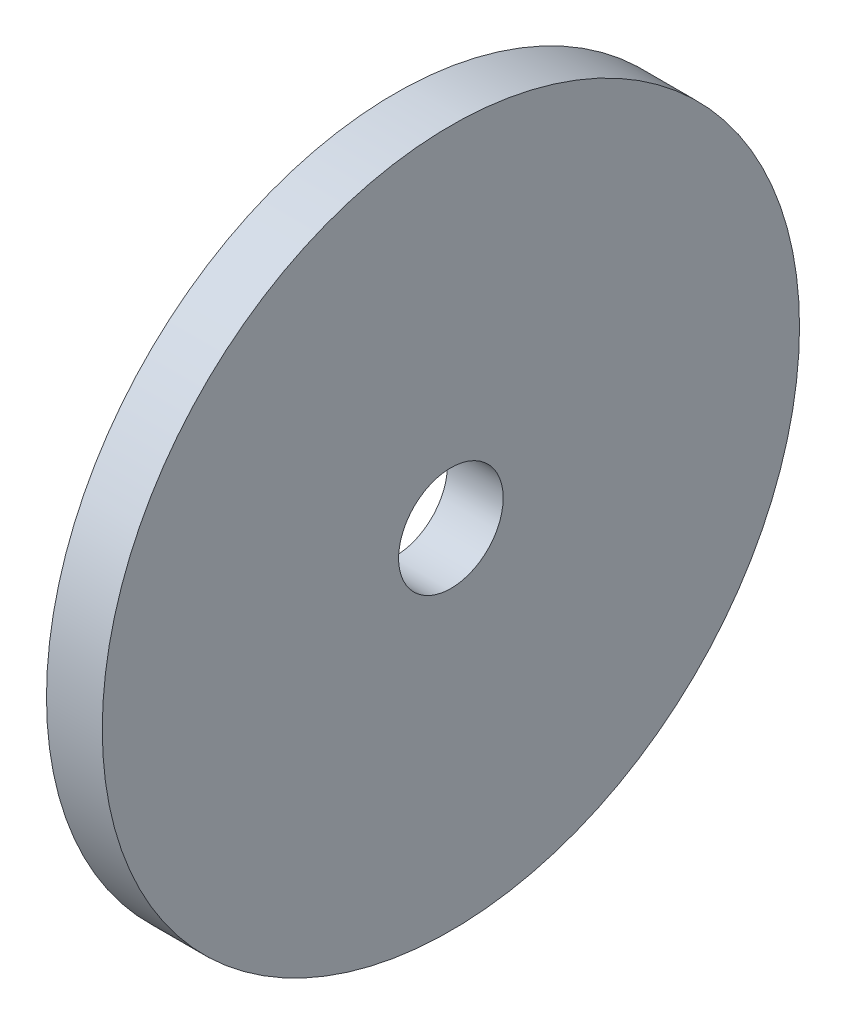
from build123d import *

# Parameters (mm, degrees)
SKETCH1_R           = 17.5
SKETCH1_R_2         = 2.625
BOSS_EXTRUDE1_DEPTH = 2.8


with BuildPart() as part:
    # Sketch1 → Boss-Extrude1 (new body)
    with BuildSketch(Plane(origin=(0, 0, 0), x_dir=(0, 0, -1), z_dir=(1, 0, 0))):
        Circle(SKETCH1_R)
        Circle(SKETCH1_R_2, mode=Mode.SUBTRACT)
    extrude(amount=BOSS_EXTRUDE1_DEPTH)


solid = part.part
